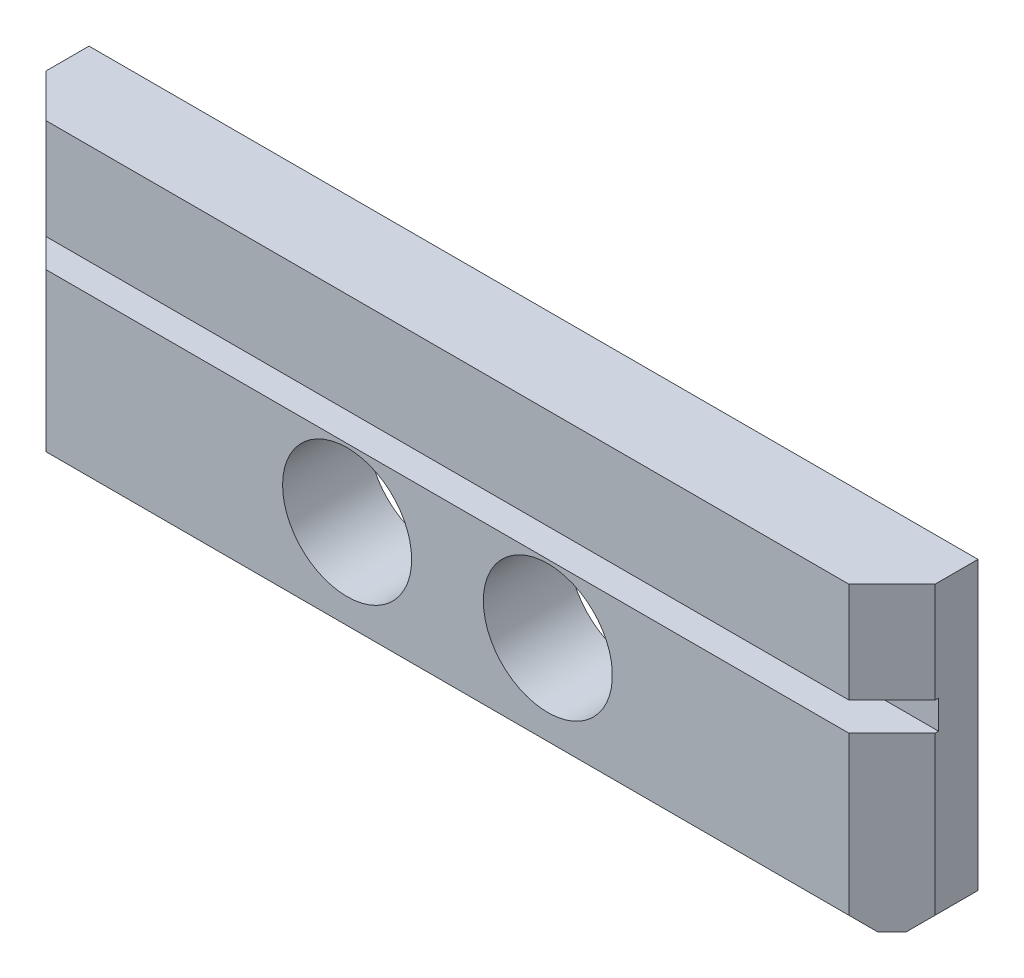
from build123d import *

# Parameters (mm, degrees)
SKETCH1_W          = 393.7
SKETCH1_H          = 38.1
EXTRUDE1_DEPTH     = 133.35
CHAMFER1_SIZE      = 19.05
CHAMFER2_SIZE      = 6.35
SKETCH2_R          = 28.575
CUT_EXTRUDE1_DEPTH = 242.945417109
SKETCH3_W          = 406.514857882
SKETCH3_H          = 12.7
CUT_EXTRUDE2_DEPTH = 22.225


with BuildPart() as part:
    # Sketch1 → Extrude1 (new body)
    with BuildSketch(Plane(origin=(0, 1.6002, 0), x_dir=(1, 0, 0), z_dir=(0, 1, 0))):
        with Locations((0, 20.6502)):
            Rectangle(SKETCH1_W, SKETCH1_H)
    extrude(amount=EXTRUDE1_DEPTH)

    # Chamfer1
    chamfer1_edges = [part.edges().sort_by_distance(p)[0] for p in [
        (196.85, 68.2752, -1.6002),
        (-196.85, 68.2752, -1.6002),
    ]]
    chamfer(chamfer1_edges, length=CHAMFER1_SIZE)

    # Chamfer2
    chamfer2_edges = [part.edges().sort_by_distance(p)[0] for p in [
        (196.85, 1.6002, -30.1752),
        (0, 1.6002, -1.6002),
        (-196.85, 1.6002, -30.1752),
    ]]
    chamfer(chamfer2_edges, length=CHAMFER2_SIZE)

    # Sketch2 → Cut-Extrude1 (cut, through all)
    with BuildSketch(Plane.XY):
        with Locations((-44.45, 47.625)):
            Circle(SKETCH2_R)
        with Locations(Location((44.45, 47.625, 0), (0, 0, 180))):
            Circle(SKETCH2_R)
    extrude(amount=-CUT_EXTRUDE1_DEPTH, mode=Mode.SUBTRACT)

    # Sketch3 → Cut-Extrude2 (cut)
    with BuildSketch(Plane.XY):
        with Locations((0, 84.1502)):
            Rectangle(SKETCH3_W, SKETCH3_H)
    extrude(amount=-CUT_EXTRUDE2_DEPTH, mode=Mode.SUBTRACT)


solid = part.part
